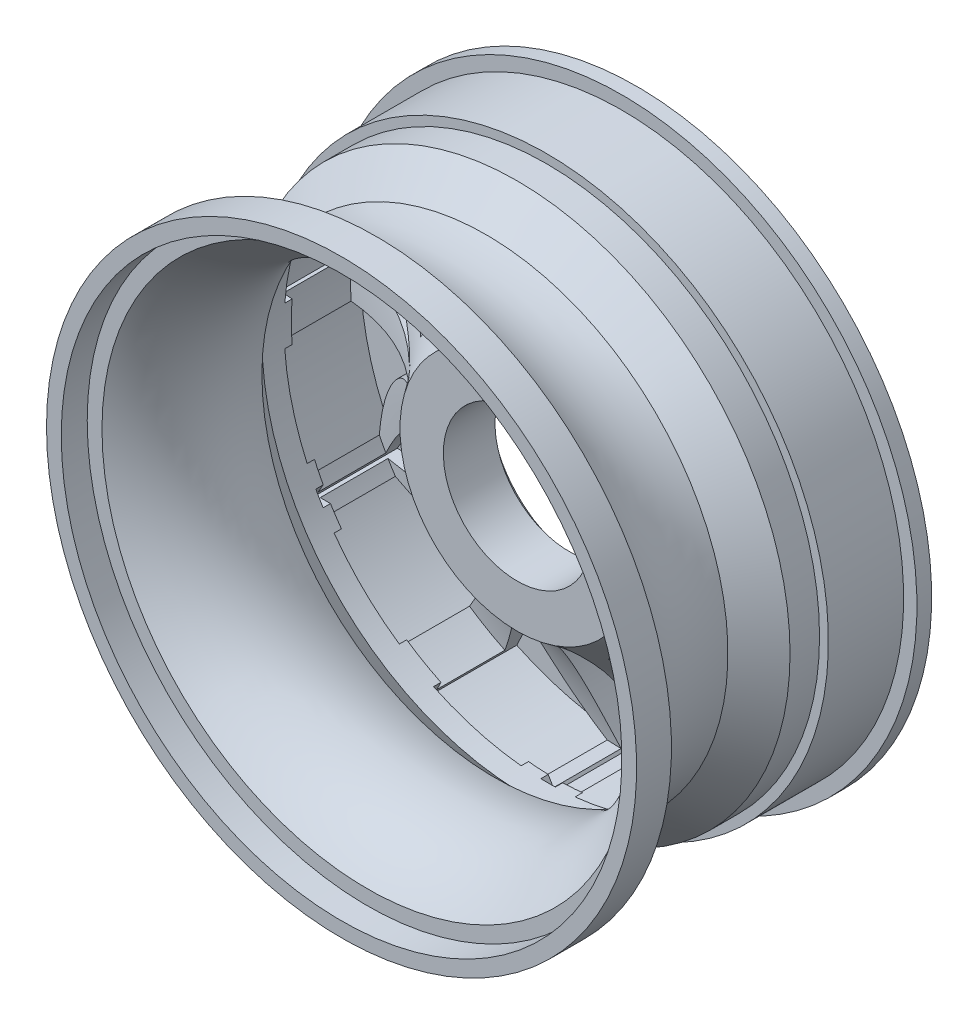
from build123d import *

# Parameters (mm, degrees)
KES_EKSTR_ZYON7_DEPTH          = 60
DAIRESEL_KAPLAMA6_COUNT        = 6
DAIRESEL_KAPLAMA6_COPY_1_DEPTH = 60
DAIRESEL_KAPLAMA6_COPY_2_DEPTH = 60
DAIRESEL_KAPLAMA6_COPY_3_DEPTH = 60
DAIRESEL_KAPLAMA6_COPY_4_DEPTH = 60
DAIRESEL_KAPLAMA6_COPY_5_DEPTH = 60


with BuildPart() as part:
    # Çizim3 → Döndür1 (revolve)
    with BuildSketch(Plane(origin=(0, 0, 0), x_dir=(0, 0, -1), z_dir=(1, 0, 0)), mode=Mode.PRIVATE) as d_nd_r1_sk:
        with BuildLine():
            Line((0, 185), (0, 200))
            Line((0, 200), (-10, 200))
            Line((-10, 200), (-10, 191))
            Line((-10, 191), (-61, 191))
            Line((-61, 191), (-61, 185))
            Line((-61, 185), (-81, 185))
            Line((-81, 185), (-102.061412307, 163.938587693))
            add(Edge.make_bspline(
                [(-176.4, 185), (-145.525947617, 152.859711167), (-102.061412307, 163.938587693)],
                knots=[0, 0, 0, 1, 1, 1], degree=2))
            Line((-176.4, 185), (-176.4, 200))
            Line((-176.4, 200), (-200, 200))
            Line((-200, 200), (-200, 190))
            Line((-200, 190), (-182.4, 190))
            Line((-182.4, 190), (-182.4, 180))
            add(Edge.make_bspline(
                [(-182.4, 180), (-146.368598578, 138.938288094), (-96.061412307, 157.938587693)],
                knots=[0, 0, 0, 1, 1, 1], degree=2))
            Line((-96.061412307, 157.938587693), (-75, 179))
            Line((-75, 179), (-55, 179))
            Line((-55, 179), (-55, 185))
            Line((-55, 185), (0, 185))
        make_face()
    revolve(d_nd_r1_sk.sketch.rotate(Axis((0, 0, 0), (0, 0, 1)), 90), axis=Axis((0, 0, 0), (0, 0, 1)))

    # Çizim5 → Döndür4 (revolve)
    with BuildSketch(Plane(origin=(0, 0, 0), x_dir=(0, 0, -1), z_dir=(1, 0, 0)), mode=Mode.PRIVATE) as d_nd_r4_sk:
        with BuildLine():
            Line((-81, 79.4), (-81, 50))
            Line((-81, 50), (-46, 50))
            add(Edge.make_bspline(
                [(-46, 50), (10.05459832, 118.535602238), (0, 197.3)],
                knots=[0, 0, 0, 1, 1, 1], degree=2))
            Line((0, 197.3), (-7.5, 197.3))
            add(Edge.make_bspline(
                [(-81, 79.4), (-14.123195975, 122.520096243), (-7.5, 197.3)],
                knots=[0, 0, 0, 1, 1, 1], degree=2))
        make_face()
    revolve(d_nd_r4_sk.sketch.rotate(Axis((0, 0, 0), (0, 0, 1)), 90), axis=Axis((0, 0, 0), (0, 0, 1)))

    # Çizim8 → Kes-Ekstrüzyon7 (cut)
    with BuildSketch(Plane.XY):
        with BuildLine():
            Line((0, -77.3), (0, -187.3))
            add(Edge.make_bspline(
                [(0, -187.3), (35.626217238, -131.232050943), (0, -77.3)],
                knots=[0, 0, 0, 1, 1, 1], degree=2))
        make_face()
        with BuildLine():
            add(Edge.make_bspline(
                [(36.695421739, -76.213410937), (64.186971752, -143.000471541), (7.825806287, -187.136438878)],
                knots=[0.113403333, 0.113403333, 0.113403333, 1, 1, 1], degree=2))
            ThreePointArc((7.825806287, -187.136438878), (45.47790724, -181.694936509), (81.253801529, -168.7575472))
            Line((81.253801529, -168.7575472), (36.695421739, -76.213410937))
        make_face()
    kes_ekstr_zyon7 = extrude(amount=KES_EKSTR_ZYON7_DEPTH, mode=Mode.SUBTRACT)

    # Aynalama5: Kes-Ekstrüzyon7 across plane
    add(kes_ekstr_zyon7.mirror(Plane(origin=(0, 0, 0), x_dir=(0, 0, 1), z_dir=(1, 0, 0))), mode=Mode.SUBTRACT)

    # Dairesel Kaplama6: Kes-Ekstrüzyon7 ×6 about axis
    dairesel_kaplama6_axis = Axis((0, 0, 0), (0, 0, -1))
    for i in range(1, DAIRESEL_KAPLAMA6_COUNT):
        add(kes_ekstr_zyon7.rotate(dairesel_kaplama6_axis, i * 360 / DAIRESEL_KAPLAMA6_COUNT), mode=Mode.SUBTRACT)

    # Dairesel Kaplama6 copy 1 sketch → Dairesel Kaplama6 copy 1 (cut)
    with BuildSketch(Plane(origin=(0, 0, 0), x_dir=(-0.5000000000000001, 0.8660254037844386, 0), z_dir=(0, 0, 1))):
        with BuildLine():
            Line((0, 77.3), (0, 187.3))
            add(Edge.make_bspline(
                [(0, 187.3), (35.626217238, 131.232050943), (0, 77.3)],
                knots=[0, 0, 0, 1, 1, 1], degree=2))
        make_face()
        with BuildLine():
            add(Edge.make_bspline(
                [(36.695421739, 76.213410937), (64.186971752, 143.000471541), (7.825806287, 187.136438878)],
                knots=[0.113403333, 0.113403333, 0.113403333, 1, 1, 1], degree=2))
            ThreePointArc((7.825806287, 187.136438878), (45.47790724, 181.694936509), (81.253801529, 168.7575472))
            Line((81.253801529, 168.7575472), (36.695421739, 76.213410937))
        make_face()
    extrude(amount=DAIRESEL_KAPLAMA6_COPY_1_DEPTH, mode=Mode.SUBTRACT)

    # Dairesel Kaplama6 copy 2 sketch → Dairesel Kaplama6 copy 2 (cut)
    with BuildSketch(Plane(origin=(0, 0, 0), x_dir=(0.4999999999999998, 0.8660254037844387, 0), z_dir=(0, 0, 1))):
        with BuildLine():
            Line((0, 77.3), (0, 187.3))
            add(Edge.make_bspline(
                [(0, 187.3), (35.626217238, 131.232050943), (0, 77.3)],
                knots=[0, 0, 0, 1, 1, 1], degree=2))
        make_face()
        with BuildLine():
            add(Edge.make_bspline(
                [(36.695421739, 76.213410937), (64.186971752, 143.000471541), (7.825806287, 187.136438878)],
                knots=[0.113403333, 0.113403333, 0.113403333, 1, 1, 1], degree=2))
            ThreePointArc((7.825806287, 187.136438878), (45.47790724, 181.694936509), (81.253801529, 168.7575472))
            Line((81.253801529, 168.7575472), (36.695421739, 76.213410937))
        make_face()
    extrude(amount=DAIRESEL_KAPLAMA6_COPY_2_DEPTH, mode=Mode.SUBTRACT)

    # Dairesel Kaplama6 copy 3 sketch → Dairesel Kaplama6 copy 3 (cut)
    with BuildSketch(Plane.XY):
        with BuildLine():
            Line((0, 77.3), (0, 187.3))
            add(Edge.make_bspline(
                [(0, 187.3), (35.626217238, 131.232050943), (0, 77.3)],
                knots=[0, 0, 0, 1, 1, 1], degree=2))
        make_face()
        with BuildLine():
            add(Edge.make_bspline(
                [(36.695421739, 76.213410937), (64.186971752, 143.000471541), (7.825806287, 187.136438878)],
                knots=[0.113403333, 0.113403333, 0.113403333, 1, 1, 1], degree=2))
            ThreePointArc((7.825806287, 187.136438878), (45.47790724, 181.694936509), (81.253801529, 168.7575472))
            Line((81.253801529, 168.7575472), (36.695421739, 76.213410937))
        make_face()
    extrude(amount=DAIRESEL_KAPLAMA6_COPY_3_DEPTH, mode=Mode.SUBTRACT)

    # Dairesel Kaplama6 copy 4 sketch → Dairesel Kaplama6 copy 4 (cut)
    with BuildSketch(Plane(origin=(0, 0, 0), x_dir=(0.5000000000000004, -0.8660254037844384, 0), z_dir=(0, 0, 1))):
        with BuildLine():
            Line((0, 77.3), (0, 187.3))
            add(Edge.make_bspline(
                [(0, 187.3), (35.626217238, 131.232050943), (0, 77.3)],
                knots=[0, 0, 0, 1, 1, 1], degree=2))
        make_face()
        with BuildLine():
            add(Edge.make_bspline(
                [(36.695421739, 76.213410937), (64.186971752, 143.000471541), (7.825806287, 187.136438878)],
                knots=[0.113403333, 0.113403333, 0.113403333, 1, 1, 1], degree=2))
            ThreePointArc((7.825806287, 187.136438878), (45.47790724, 181.694936509), (81.253801529, 168.7575472))
            Line((81.253801529, 168.7575472), (36.695421739, 76.213410937))
        make_face()
    extrude(amount=DAIRESEL_KAPLAMA6_COPY_4_DEPTH, mode=Mode.SUBTRACT)

    # Dairesel Kaplama6 copy 5 sketch → Dairesel Kaplama6 copy 5 (cut)
    with BuildSketch(Plane(origin=(0, 0, 0), x_dir=(-0.5000000000000001, -0.8660254037844386, 0), z_dir=(0, 0, 1))):
        with BuildLine():
            Line((0, 77.3), (0, 187.3))
            add(Edge.make_bspline(
                [(0, 187.3), (35.626217238, 131.232050943), (0, 77.3)],
                knots=[0, 0, 0, 1, 1, 1], degree=2))
        make_face()
        with BuildLine():
            add(Edge.make_bspline(
                [(36.695421739, 76.213410937), (64.186971752, 143.000471541), (7.825806287, 187.136438878)],
                knots=[0.113403333, 0.113403333, 0.113403333, 1, 1, 1], degree=2))
            ThreePointArc((7.825806287, 187.136438878), (45.47790724, 181.694936509), (81.253801529, 168.7575472))
            Line((81.253801529, 168.7575472), (36.695421739, 76.213410937))
        make_face()
    extrude(amount=DAIRESEL_KAPLAMA6_COPY_5_DEPTH, mode=Mode.SUBTRACT)


solid = part.part
